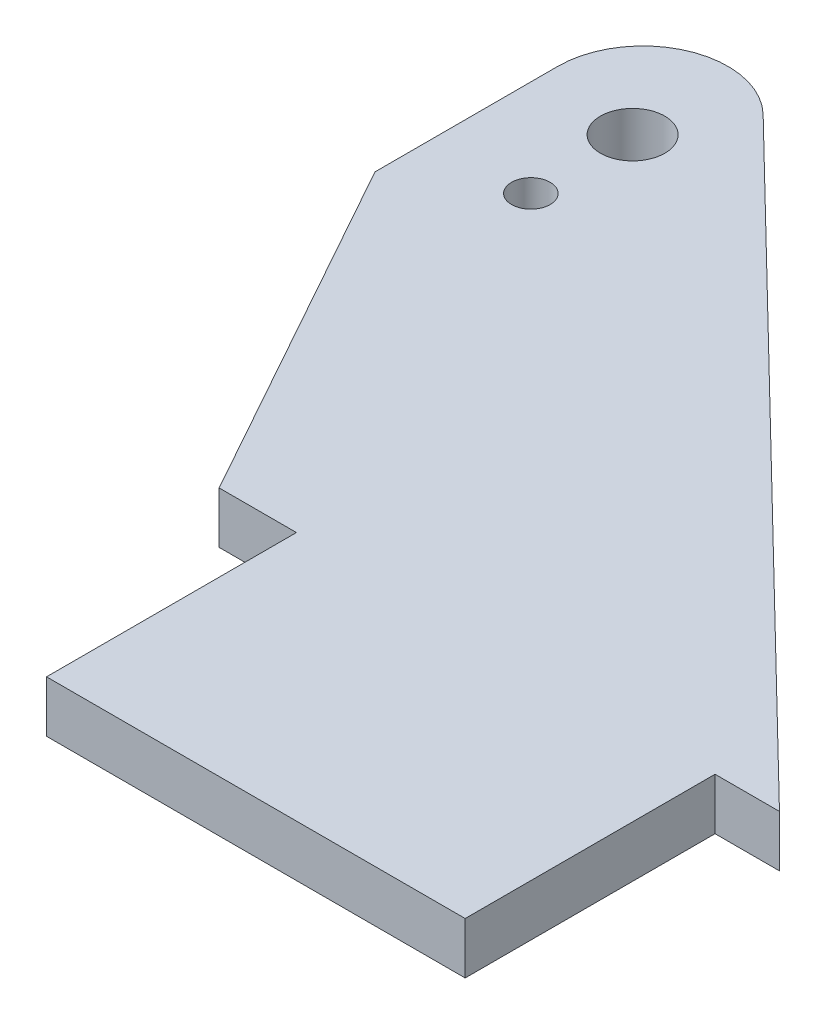
from build123d import *

# Parameters (mm, degrees)
BOSS_EXTRUDE1_DEPTH = 1.016
SKETCH2_R           = 0.635
SKETCH2_R_2         = 0.381
CUT_EXTRUDE1_DEPTH  = 20.63947316


with BuildPart() as part:
    # Sketch1 → Boss-Extrude1 (new body)
    with BuildSketch(Plane(origin=(0, 0, 0), x_dir=(1, 0, 0), z_dir=(0, 1, 0))):
        with BuildLine():
            Line((0, 0), (8.255, 0))
            Line((8.255, 0), (8.255, 4.9276))
            Line((8.255, 4.9276), (9.525, 4.9276))
            Line((9.525, 4.9276), (-2.539137852, 16.669908865))
            ThreePointArc((-2.539137852, 16.669908865), (-4.360383855, 17.013020284), (-5.3848, 15.4686))
            Line((-5.3848, 15.4686), (-5.3848, 11.8618))
            Line((-5.3848, 11.8618), (-1.524, 4.9276))
            Line((-1.524, 4.9276), (0, 4.9276))
            Line((0, 4.9276), (0, 0))
        make_face()
    extrude(amount=BOSS_EXTRUDE1_DEPTH)

    # Sketch2 → Cut-Extrude1 (cut, through all)
    with BuildSketch(Plane(origin=(0, 1.016, 0), x_dir=(1, 0, 0), z_dir=(0, 1, 0))):
        with Locations(Location((-3.4798, 15.0368, 0), (0, 0, 270))):
            Circle(SKETCH2_R)
        with Locations(Location((-3.4798, 13.0302, 0), (0, 0, 270))):
            Circle(SKETCH2_R_2)
    extrude(amount=-CUT_EXTRUDE1_DEPTH, mode=Mode.SUBTRACT)


solid = part.part
